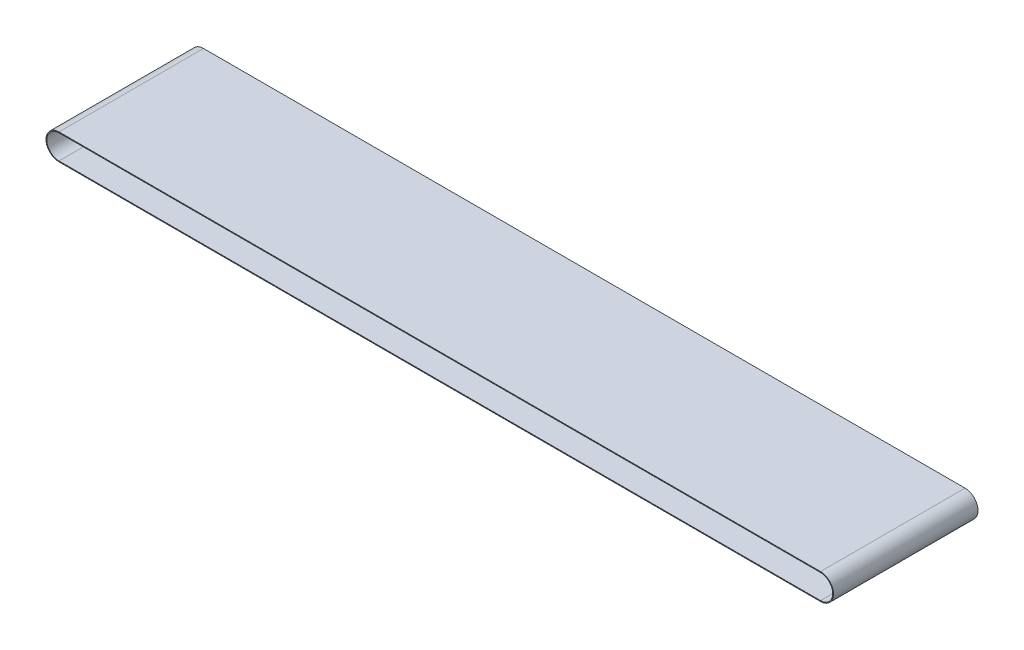
from build123d import *

# Parameters (mm, degrees)
CROQUIS1_W              = 485
CROQUIS1_H              = 89
SALIENTE_EXTRUIR1_DEPTH = 16
CORTAR_EXTRUIR2_DEPTH   = 89
CORTAR_EXTRUIR3_DEPTH   = 89
CORTAR_EXTRUIR4_DEPTH   = 89


with BuildPart() as part:
    # Croquis1 → Saliente-Extruir1 (new body)
    with BuildSketch(Plane(origin=(0, 0, 0), x_dir=(1, 0, 0), z_dir=(0, 1, 0))):
        Rectangle(CROQUIS1_W, CROQUIS1_H)
    extrude(amount=SALIENTE_EXTRUIR1_DEPTH)

    # Croquis2 → Cortar-Extruir2 (cut)
    with BuildSketch(Plane.XY.offset(44.5)):
        with BuildLine():
            ThreePointArc((-234.5, 0), (-240.156854249, 2.343145751), (-242.5, 8))
            Line((-242.5, 8), (-242.5, 0))
            Line((-242.5, 0), (-234.5, 0))
        make_face()
        with BuildLine():
            ThreePointArc((-242.5, 8), (-240.156854236, 13.656854263), (-234.499999961, 16))
            Line((-234.499999961, 16), (-242.5, 16))
            Line((-242.5, 16), (-242.5, 8))
        make_face()
    extrude(amount=-CORTAR_EXTRUIR2_DEPTH, mode=Mode.SUBTRACT)

    # Croquis3 → Cortar-Extruir3 (cut)
    with BuildSketch(Plane.XY.offset(44.5)):
        with BuildLine():
            Line((242.5, 16), (234.5, 16))
            ThreePointArc((234.5, 16), (240.156854249, 13.656854249), (242.5, 8))
            Line((242.5, 8), (242.5, 16))
        make_face()
        with BuildLine():
            Line((242.5, 0), (242.5, 8))
            ThreePointArc((242.5, 8), (240.156854249, 2.343145751), (234.5, 0))
            Line((234.5, 0), (242.5, 0))
        make_face()
    extrude(amount=-CORTAR_EXTRUIR3_DEPTH, mode=Mode.SUBTRACT)

    # Croquis4 → Cortar-Extruir4 (cut)
    with BuildSketch(Plane.XY.offset(44.5)):
        with BuildLine():
            Line((-234.5, 15.5), (234.5, 15.5))
            ThreePointArc((234.5, 15.5), (242, 8), (234.5, 0.5))
            Line((234.5, 0.5), (-234.5, 0.5))
            ThreePointArc((-234.5, 0.5), (-242, 8), (-234.5, 15.5))
        make_face()
    extrude(amount=-CORTAR_EXTRUIR4_DEPTH, mode=Mode.SUBTRACT)


solid = part.part
